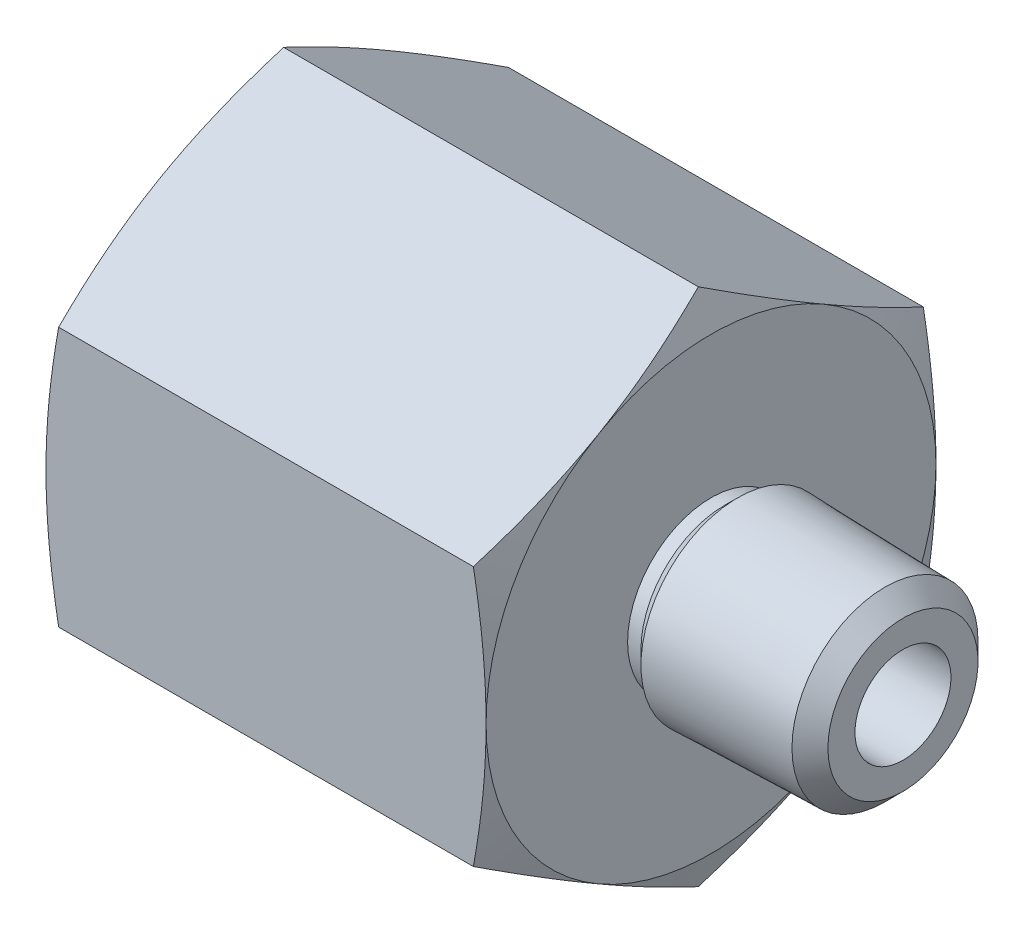
from build123d import *

# Parameters (mm, degrees)
EXTRUDE1_DEPTH     = 32.60725
SKETCH3_OUTSIDE_W  = 280.258
SKETCH3_OUTSIDE_H  = 285.414
SKETCH3_OUTSIDE_R  = 16.66875
CUT_EXTRUDE1_DEPTH = 42.37079825
CUT_EXTRUDE1_DRAFT = -70
SKETCH4_OUTSIDE_W  = 280.258
SKETCH4_OUTSIDE_H  = 285.414
SKETCH4_OUTSIDE_R  = 16.66875
CUT_EXTRUDE2_DEPTH = 42.37079825
CUT_EXTRUDE2_DRAFT = -70
SKETCH5_R          = 6.858
EXTRUDE2_DEPTH     = 14.224
EXTRUDE2_DRAFT     = 1.5
SKETCH7_R          = 13.335
CUT_EXTRUDE4_DEPTH = 42.657677412
CUT_EXTRUDE4_DRAFT = 1.5
SKETCH12_W         = 6.35
SKETCH12_H         = 19.247414599
SKETCH15_R         = 13.926557298
CUT_EXTRUDE7_DEPTH = 5.08
CUT_EXTRUDE7_DRAFT = -45


with BuildPart() as part:
    # Sketch2 → Extrude1 (new body)
    with BuildSketch(Plane(origin=(-23.415625, 0, 0), x_dir=(0, 0, -1), z_dir=(1, 0, 0))):
        Polygon((0, 19.247414599), (-16.66875, 9.6237073), (-16.66875, -9.6237073), (0, -19.247414599), (16.66875, -9.6237073), (16.66875, 9.6237073), align=None)
    extrude(amount=EXTRUDE1_DEPTH)


with BuildPart() as cut_extrude1_tool:
    # Sketch3 outside → Cut-Extrude1 (with draft: the straight prism first)
    with BuildSketch(Plane(origin=(9.191625, 0, 0), x_dir=(0, 0, -1), z_dir=(1, 0, 0))):
        Rectangle(SKETCH3_OUTSIDE_W, SKETCH3_OUTSIDE_H)
        Circle(SKETCH3_OUTSIDE_R, mode=Mode.SUBTRACT)
    extrude(amount=-CUT_EXTRUDE1_DEPTH)
    # Cut-Extrude1: the draft: its side faces are tilted about the plane it starts from
    cut_extrude1_sides = [cut_extrude1_tool.faces().sort_by_distance(p)[0] for p in [
        (-11.993774125, -142.707, 0),
        (-11.993774125, 0, -140.129),
        (-11.993774125, 142.707, 0),
        (-11.993774125, 0, 140.129),
        (-11.993774125, 0, 16.66875),
    ]]
    draft(cut_extrude1_sides, Plane(origin=(9.191625, 0, 0), x_dir=(0, 0, -1), z_dir=(1, 0, 0)), CUT_EXTRUDE1_DRAFT)


with BuildPart() as part_1:
    add(part.part)

    # Cut-Extrude1: cut by cut_extrude1_tool
    add(cut_extrude1_tool.part, mode=Mode.SUBTRACT)


with BuildPart() as cut_extrude2_tool:
    # Sketch4 outside → Cut-Extrude2 (with draft: the straight prism first)
    with BuildSketch(Plane.ZY.offset(23.415625)):
        Rectangle(SKETCH4_OUTSIDE_W, SKETCH4_OUTSIDE_H)
        Circle(SKETCH4_OUTSIDE_R, mode=Mode.SUBTRACT)
    extrude(amount=-CUT_EXTRUDE2_DEPTH)
    # Cut-Extrude2: the draft: its side faces are tilted about the plane it starts from
    cut_extrude2_sides = [cut_extrude2_tool.faces().sort_by_distance(p)[0] for p in [
        (-2.230225875, -142.707, 0),
        (-2.230225875, 0, 140.129),
        (-2.230225875, 142.707, 0),
        (-2.230225875, 0, -140.129),
        (-2.230225875, 0, -16.66875),
    ]]
    draft(cut_extrude2_sides, Plane.ZY.offset(23.415625), CUT_EXTRUDE2_DRAFT)


with BuildPart() as part_2:
    add(part_1.part)

    # Cut-Extrude2: cut by cut_extrude2_tool
    add(cut_extrude2_tool.part, mode=Mode.SUBTRACT)


with BuildPart() as body_2:
    # Sketch5 → Extrude2 (with draft: the straight prism first)
    with BuildSketch(Plane(origin=(23.415625, 0, 0), x_dir=(0, 0, -1), z_dir=(1, 0, 0))):
        Circle(SKETCH5_R)
    extrude(amount=-EXTRUDE2_DEPTH)
    # Extrude2: the draft: its side faces are tilted about the plane it starts from
    extrude2_sides = [body_2.faces().sort_by_distance(p)[0] for p in [
        (16.303625, 0, 6.858),
    ]]
    draft(extrude2_sides, Plane(origin=(23.415625, 0, 0), x_dir=(0, 0, -1), z_dir=(1, 0, 0)), EXTRUDE2_DRAFT)

    # Sketch17 → Cut-Revolve2 (revolve, cut)
    with BuildSketch(Plane.XY, mode=Mode.PRIVATE) as cut_revolve2_sk:
        Polygon((23.415625, 7.100390815), (23.415625, 5.560456448), (21.875690632, 7.100390815), align=None)
        Polygon((9.191625, 6.179304996), (10.179402778, 6.179304996), (11.481488597, 7.481390815), (9.191625, 7.481390815), align=None)
    revolve(cut_revolve2_sk.sketch.rotate(Axis((-23.415625, 0, 0), (1, 0, 0)), 270), axis=Axis((-23.415625, 0, 0), (1, 0, 0)), mode=Mode.SUBTRACT)


with BuildPart() as cut_extrude4_tool:
    # Sketch7 → Cut-Extrude4 (with draft: the straight prism first)
    with BuildSketch(Plane(origin=(-9.554845, 0, 0), x_dir=(0, 0, -1), z_dir=(1, 0, 0))):
        Circle(SKETCH7_R)
    extrude(amount=-CUT_EXTRUDE4_DEPTH)
    # Cut-Extrude4: the draft: its side faces are tilted about the plane it starts from
    cut_extrude4_sides = [cut_extrude4_tool.faces().sort_by_distance(p)[0] for p in [
        (-30.883683706, 0, 13.335),
    ]]
    draft(cut_extrude4_sides, Plane(origin=(-9.554845, 0, 0), x_dir=(0, 0, -1), z_dir=(1, 0, 0)), CUT_EXTRUDE4_DRAFT)


with BuildPart() as part_3:
    add(part_2.part)

    # Cut-Extrude4: cut by cut_extrude4_tool
    add(cut_extrude4_tool.part, mode=Mode.SUBTRACT)


with BuildPart() as body_2_1:
    add(body_2.part)

    # Combine1: union part
    add(part_3.part)

    # Sketch12 → Cut-Revolve1 (revolve, cut)
    with BuildSketch(Plane.XY, mode=Mode.PRIVATE) as cut_revolve1_sk:
        Polygon((-9.554845, 12.745793431), (-9.554845, 0), (23.415625, 0), (23.415625, 3.556), (-0.365051569, 3.556), align=None)
        with Locations((-26.590625, 9.6237073)):
            Rectangle(SKETCH12_W, SKETCH12_H)
    revolve(cut_revolve1_sk.sketch.rotate(Axis((-23.415625, 0, 0), (1, 0, 0)), 90), axis=Axis((-23.415625, 0, 0), (1, 0, 0)), mode=Mode.SUBTRACT)


with BuildPart() as cut_extrude7_tool:
    # Sketch15 → Cut-Extrude7 (with draft: the straight prism first)
    with BuildSketch(Plane.ZY.offset(23.415625)):
        Circle(SKETCH15_R)
    extrude(amount=-CUT_EXTRUDE7_DEPTH)
    # Cut-Extrude7: the draft: its side faces are tilted about the plane it starts from
    cut_extrude7_sides = [cut_extrude7_tool.faces().sort_by_distance(p)[0] for p in [
        (-20.875625, 0, -13.926557298),
    ]]
    draft(cut_extrude7_sides, Plane.ZY.offset(23.415625), CUT_EXTRUDE7_DRAFT)


with BuildPart() as body_2_2:
    add(body_2_1.part)

    # Cut-Extrude7: cut by cut_extrude7_tool
    add(cut_extrude7_tool.part, mode=Mode.SUBTRACT)


solid = body_2_2.part
